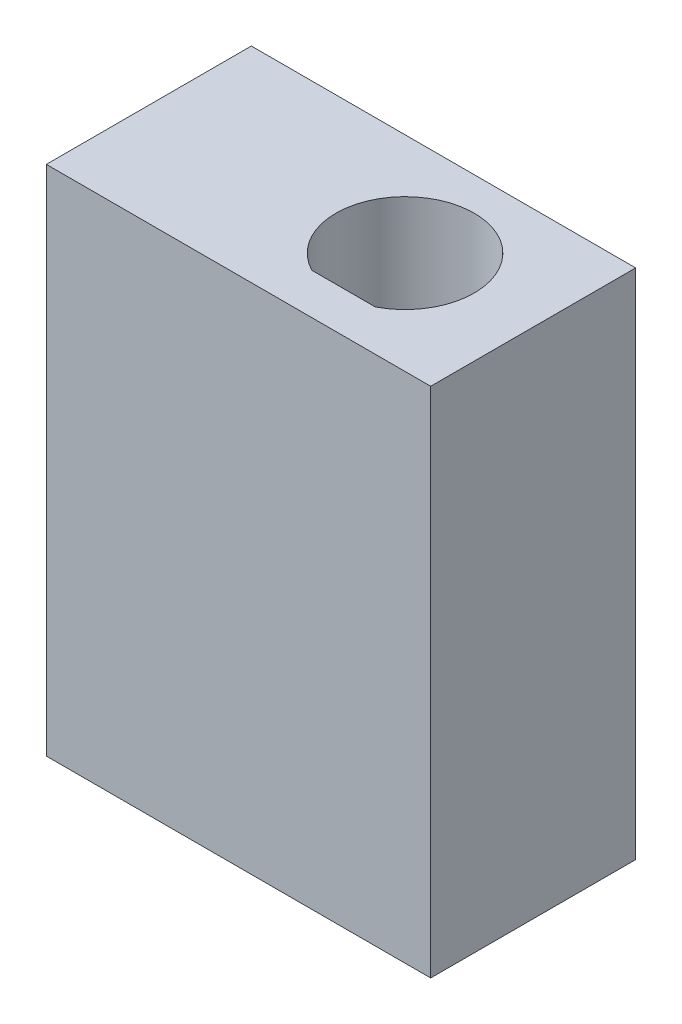
from build123d import *

# Parameters (mm, degrees)
SKETCH_1_W      = 15
SKETCH_1_H      = 8
EXTRUDE_1_DEPTH = 20


with BuildPart() as part:
    # 草图1 → 凸台-拉伸1 (new body)
    with BuildSketch(Plane(origin=(0, 0, 0), x_dir=(1, 0, 0), z_dir=(0, 1, 0))):
        with Locations((7.5, 4)):
            Rectangle(SKETCH_1_W, SKETCH_1_H)
        with BuildLine():
            Line((8.763068312, 1.6), (11.236931688, 1.6))
            ThreePointArc((11.236931688, 1.6), (10, 6.7), (8.763068312, 1.6))
        make_face(mode=Mode.SUBTRACT)
    extrude(amount=EXTRUDE_1_DEPTH)


solid = part.part
